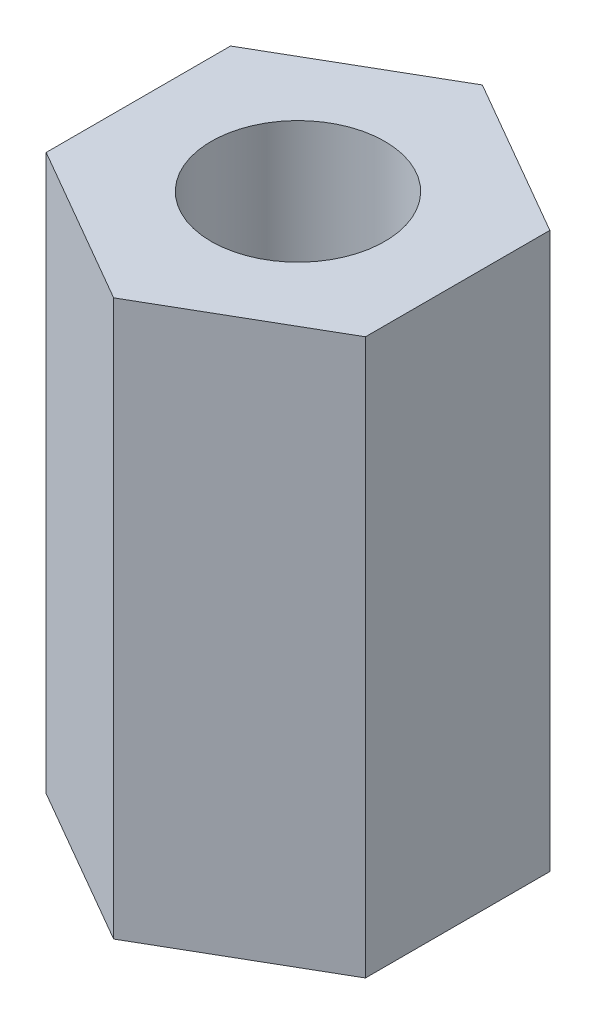
from build123d import *

# Parameters (mm, degrees)
BOSS_EXTRUDE1_DEPTH   = 4
M3_TAPPED_HOLE1_D     = 2.5
M3_TAPPED_HOLE1_DEPTH = 17.5
M3_TAPPED_HOLE1_TIP   = 0.751075774


with BuildPart() as part:
    # Sketch1 → Boss-Extrude1 (new, symmetric)
    with BuildSketch(Plane(origin=(0, 0, 0), x_dir=(1, 0, 0), z_dir=(0, 1, 0))):
        Polygon((2.3, -1.327905619), (2.3, 1.327905619), (0, 2.655811238), (-2.3, 1.327905619), (-2.3, -1.327905619), (0, -2.655811238), align=None)
    extrude(amount=BOSS_EXTRUDE1_DEPTH, both=True)

    # M3 Tapped Hole1
    with Locations(Plane(origin=(0, 4, 0), x_dir=(1, 0, 0), z_dir=(0, 1, 0))):
        with Locations((0, 0)):
            Hole(M3_TAPPED_HOLE1_D / 2, depth=M3_TAPPED_HOLE1_DEPTH)
            with Locations((0, 0, -(M3_TAPPED_HOLE1_DEPTH + M3_TAPPED_HOLE1_TIP / 2))):  # 118° drill point
                Cone(0, M3_TAPPED_HOLE1_D / 2, M3_TAPPED_HOLE1_TIP, mode=Mode.SUBTRACT)


solid = part.part
